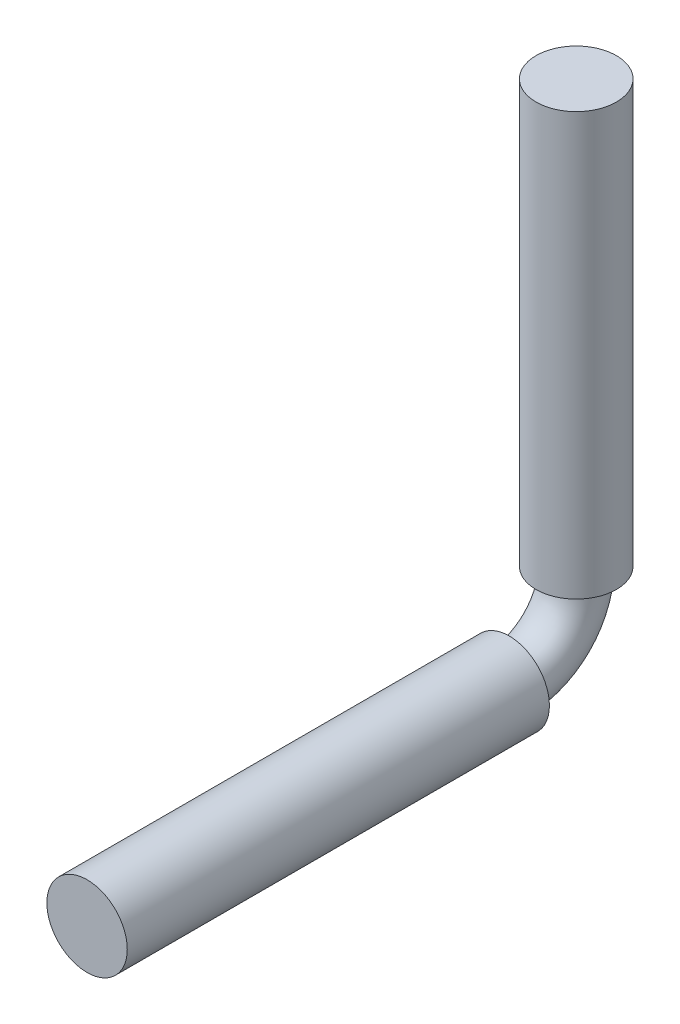
from build123d import *

# Parameters (mm, degrees)
SKETCH1_R           = 3
BOSS_EXTRUDE1_DEPTH = 31.5
SKETCH4_R           = 2
SKETCH9_R           = 3
BOSS_EXTRUDE2_DEPTH = 31.5


with BuildPart() as part:
    # Sketch1 → Boss-Extrude1 (new body)
    with BuildSketch(Plane.XY):
        Circle(SKETCH1_R)
    extrude(amount=BOSS_EXTRUDE1_DEPTH)

    # Sweep1: sweep along a path in Sketch5
    with BuildLine(Plane(origin=(0, 0, 0), x_dir=(0, 0, -1), z_dir=(1, 0, 0))) as sweep1_path:
        ThreePointArc((0, 0), (3.535533906, 1.464466094), (5, 5))
    # Sketch4 → Sweep1 (sweep)
    with BuildSketch(Plane(origin=(0, 0, 0), x_dir=(-1, 0, 0), z_dir=(0, 0, -1))):
        Circle(SKETCH4_R)
    sweep(path=sweep1_path.line)

    # Sketch9 → Boss-Extrude2 (add)
    with BuildSketch(Plane(origin=(0, 5, 0), x_dir=(1, 0, 0), z_dir=(0, 1, 0))):
        with Locations(Location((0, 5, 0), (0, 0, 270))):
            Circle(SKETCH9_R)
    extrude(amount=BOSS_EXTRUDE2_DEPTH)


solid = part.part
